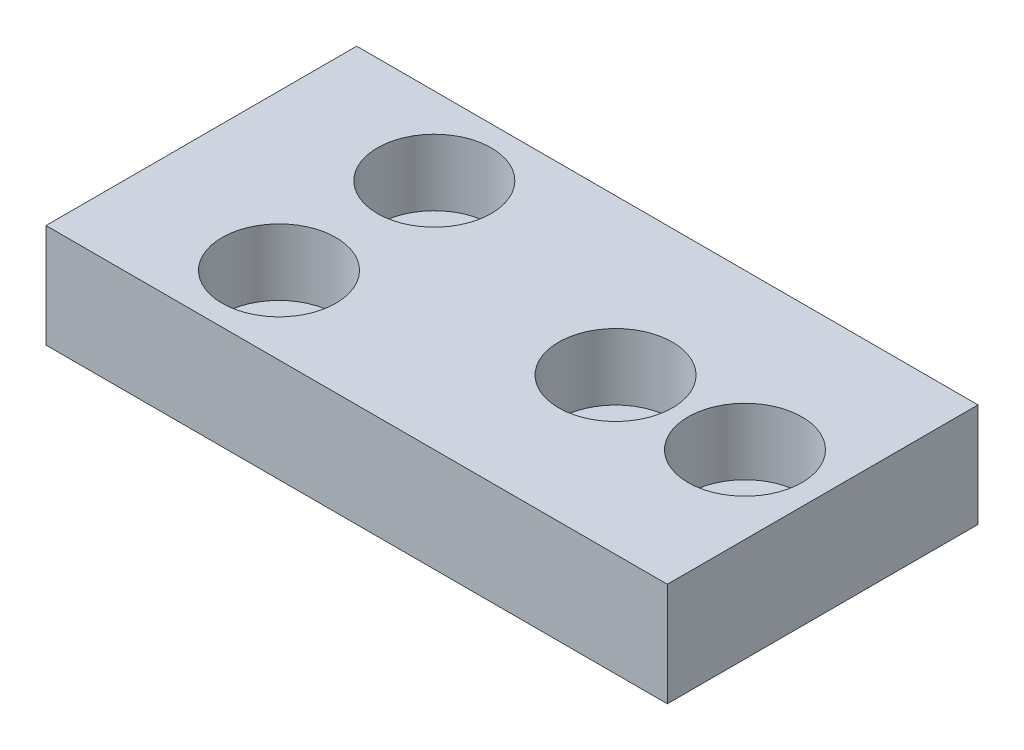
from build123d import *

# Parameters (mm, degrees)
SKETCH1_W                                           = 60
SKETCH1_H                                           = 30
BOSS_EXTRUDE1_DEPTH                                 = 5
CBORE_FOR_M6_HEX_SOCKET_HEAD_CAP_SCREW1_D           = 6.6
CBORE_FOR_M6_HEX_SOCKET_HEAD_CAP_SCREW1_CBORE_D     = 11
CBORE_FOR_M6_HEX_SOCKET_HEAD_CAP_SCREW1_CBORE_DEPTH = 6.4
CBORE_FOR_M6_HEX_SOCKET_HEAD_CAP_SCREW2_D           = 6.6
CBORE_FOR_M6_HEX_SOCKET_HEAD_CAP_SCREW2_CBORE_D     = 11
CBORE_FOR_M6_HEX_SOCKET_HEAD_CAP_SCREW2_CBORE_DEPTH = 6.4


with BuildPart() as part:
    # Sketch1 → Boss-Extrude1 (new, symmetric)
    with BuildSketch(Plane(origin=(0, 0, 0), x_dir=(1, 0, 0), z_dir=(0, 1, 0))):
        Rectangle(SKETCH1_W, SKETCH1_H)
    extrude(amount=BOSS_EXTRUDE1_DEPTH, both=True)

    # CBORE for M6 Hex Socket Head Cap Screw1 (through all)
    with Locations(Plane(origin=(0, 5, 0), x_dir=(1, 0, 0), z_dir=(0, 1, 0))):
        with Locations((-15, 7.5), (-15, -7.5)):
            CounterBoreHole(CBORE_FOR_M6_HEX_SOCKET_HEAD_CAP_SCREW1_D / 2, CBORE_FOR_M6_HEX_SOCKET_HEAD_CAP_SCREW1_CBORE_D / 2, CBORE_FOR_M6_HEX_SOCKET_HEAD_CAP_SCREW1_CBORE_DEPTH)

    # CBORE for M6 Hex Socket Head Cap Screw2 (through all)
    with Locations(Plane(origin=(0, 5, 0), x_dir=(1, 0, 0), z_dir=(0, 1, 0))):
        with Locations((10, 0), (22.5, 0)):
            CounterBoreHole(CBORE_FOR_M6_HEX_SOCKET_HEAD_CAP_SCREW2_D / 2, CBORE_FOR_M6_HEX_SOCKET_HEAD_CAP_SCREW2_CBORE_D / 2, CBORE_FOR_M6_HEX_SOCKET_HEAD_CAP_SCREW2_CBORE_DEPTH)


solid = part.part
